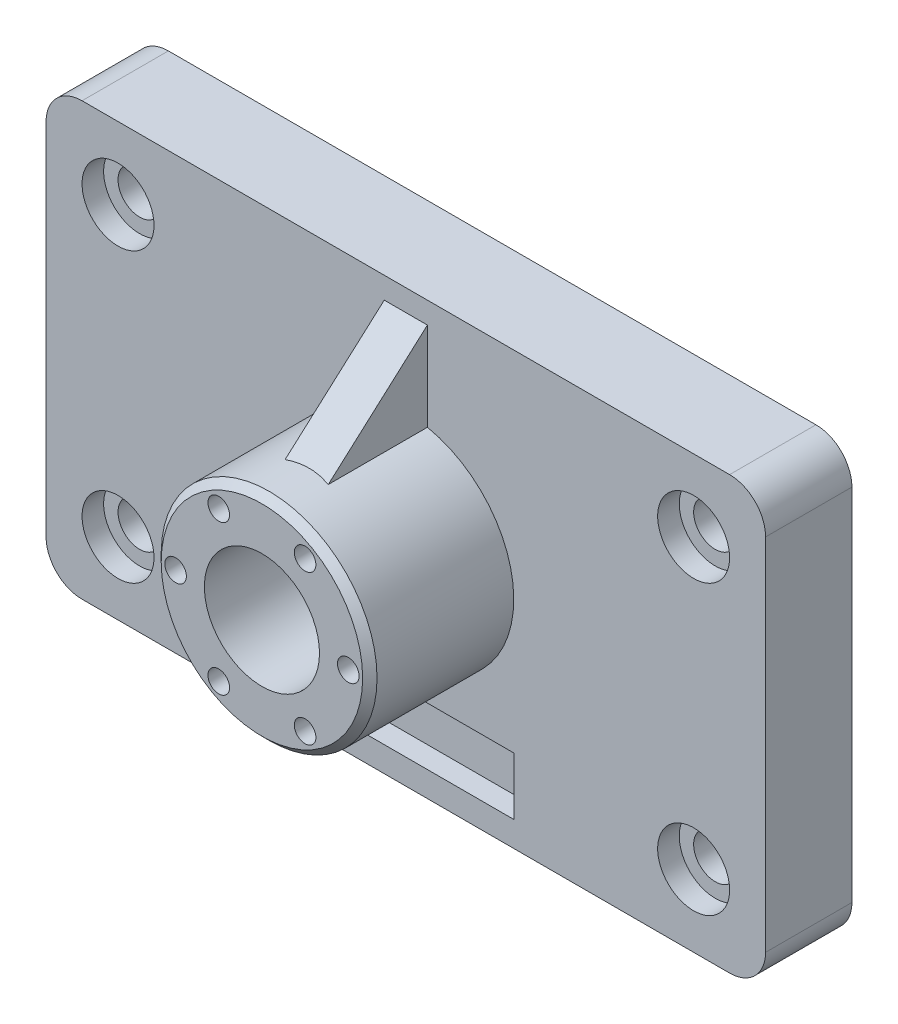
from build123d import *

# Parameters (mm, degrees)
SKETCH1_W           = 100
SKETCH1_H           = 60
BOSS_EXTRUDE1_DEPTH = 12
FILLET1_R           = 5
SKETCH2_R           = 15
BOSS_EXTRUDE2_DEPTH = 20
CHAMFER1_SIZE       = 1
SKETCH3_R           = 8
CUT_EXTRUDE2_DEPTH  = 67.513156593
SKETCH4_R           = 5
CUT_EXTRUDE4_DEPTH  = 3
SKETCH5_R           = 3
CUT_EXTRUDE6_DEPTH  = 62.64414003
SKETCH6_W           = 30
SKETCH6_H           = 8
CUT_EXTRUDE8_DEPTH  = 3
SKETCH7_R           = 1.5
CUT_EXTRUDE10_DEPTH = 8
CIRPATTERN1_COUNT   = 6
RIB2_REACH          = 68.513
SKETCH8_2_WALL_W    = 153.794637566
SKETCH8_2_WALL_H    = 6


with BuildPart() as part:
    # Sketch1 → Boss-Extrude1 (new body)
    with BuildSketch(Plane.XY):
        Rectangle(SKETCH1_W, SKETCH1_H)
    extrude(amount=BOSS_EXTRUDE1_DEPTH)

    # Fillet1
    fillet1_edges = [part.edges().sort_by_distance(p)[0] for p in [
        (-50, 30, 6),
        (50, 30, 6),
        (50, -30, 6),
        (-50, -30, 6),
    ]]
    fillet(fillet1_edges, radius=FILLET1_R)

    # Sketch2 → Boss-Extrude2 (add)
    with BuildSketch(Plane.XY.offset(12)):
        Circle(SKETCH2_R)
    extrude(amount=BOSS_EXTRUDE2_DEPTH)

    # Chamfer1
    chamfer1_edges = [part.edges().sort_by_distance(p)[0] for p in [
        (-15, 0, 32),
    ]]
    chamfer(chamfer1_edges, length=CHAMFER1_SIZE)

    # Sketch3 → Cut-Extrude2 (cut, through all)
    with BuildSketch(Plane.XY.offset(32)):
        Circle(SKETCH3_R)
    extrude(amount=-CUT_EXTRUDE2_DEPTH, mode=Mode.SUBTRACT)

    # Sketch4 → Cut-Extrude4 (cut)
    with BuildSketch(Plane.XY.offset(12)):
        with Locations((-40, -20)):
            Circle(SKETCH4_R)
        with Locations((-40, 20)):
            Circle(SKETCH4_R)
        with Locations((40, -20)):
            Circle(SKETCH4_R)
        with Locations((40, 20)):
            Circle(SKETCH4_R)
    extrude(amount=-CUT_EXTRUDE4_DEPTH, mode=Mode.SUBTRACT)

    # Sketch5 → Cut-Extrude6 (cut, through all)
    with BuildSketch(Plane.XY.offset(12)):
        with Locations((-40, -20)):
            Circle(SKETCH5_R)
        with Locations((-40, 20)):
            Circle(SKETCH5_R)
        with Locations((40, -20)):
            Circle(SKETCH5_R)
        with Locations((40, 20)):
            Circle(SKETCH5_R)
    extrude(amount=-CUT_EXTRUDE6_DEPTH, mode=Mode.SUBTRACT)

    # Sketch6 → Cut-Extrude8 (cut)
    with BuildSketch(Plane.XY.offset(12)):
        with Locations((0, -22.5)):
            Rectangle(SKETCH6_W, SKETCH6_H)
    extrude(amount=-CUT_EXTRUDE8_DEPTH, mode=Mode.SUBTRACT)

    # Sketch7 → Cut-Extrude10 (cut)
    with BuildSketch(Plane.XY.offset(32)):
        with Locations((12, 0)):
            Circle(SKETCH7_R)
    cut_extrude10 = extrude(amount=-CUT_EXTRUDE10_DEPTH, mode=Mode.SUBTRACT)

    # CirPattern1: Cut-Extrude10 ×6 about axis
    cirpattern1_axis = Axis((0, 0, -1.6), (0, 0, 1))
    for i in range(1, CIRPATTERN1_COUNT):
        add(cut_extrude10.rotate(cirpattern1_axis, i * 360 / CIRPATTERN1_COUNT), mode=Mode.SUBTRACT)

    # Sketch8<2> wall → Rib2 (add, up to next)
    with BuildSketch(Plane(origin=(0, 20.75, 19), x_dir=(0, -0.666015769309, 0.745937661626), z_dir=(0, -0.745937661626, -0.666015769309)), mode=Mode.PRIVATE) as rib2_sk1:
        Rectangle(SKETCH8_2_WALL_W, SKETCH8_2_WALL_H)
    rib2_tool1 = extrude(rib2_sk1.sketch, amount=RIB2_REACH, mode=Mode.PRIVATE) - part.part
    add(rib2_tool1.solids().sort_by_distance((0, 20.75, 19))[0])


solid = part.part
